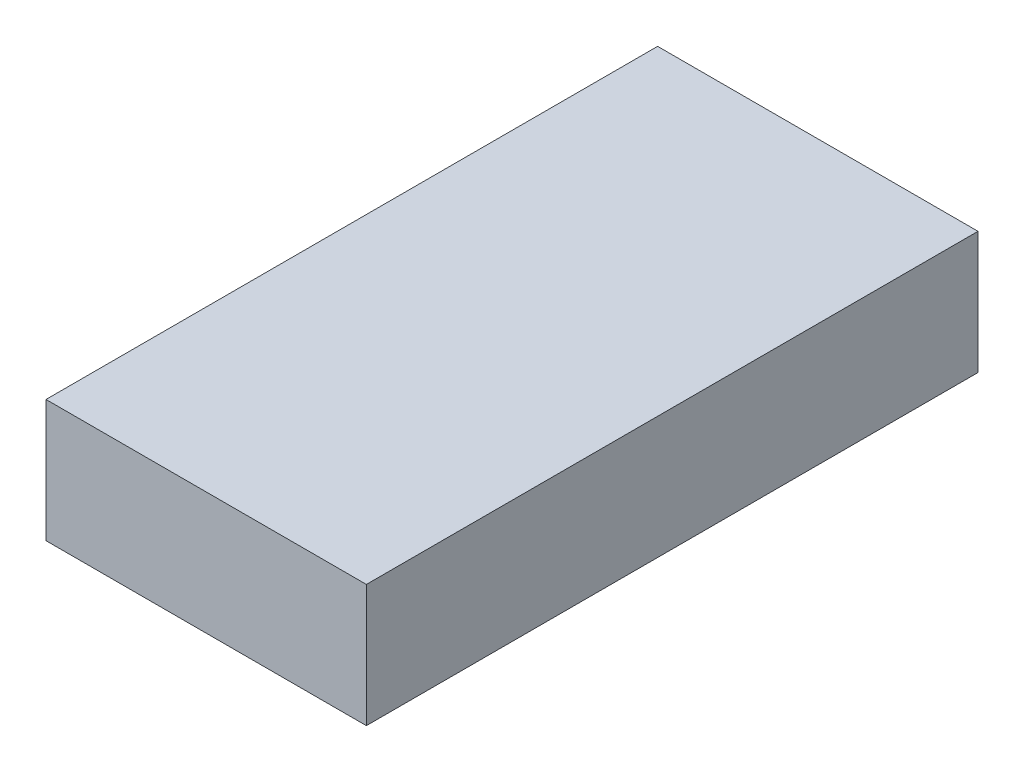
from build123d import *

# Parameters (mm, degrees)
SKETCH1_W           = 27.94
SKETCH1_H           = 53.34
BOSS_EXTRUDE1_DEPTH = 10.668


with BuildPart() as part:
    # Sketch1 → Boss-Extrude1 (new body)
    with BuildSketch(Plane(origin=(0, 0, 0), x_dir=(1, 0, 0), z_dir=(0, 1, 0))):
        Rectangle(SKETCH1_W, SKETCH1_H)
    extrude(amount=BOSS_EXTRUDE1_DEPTH)


solid = part.part
